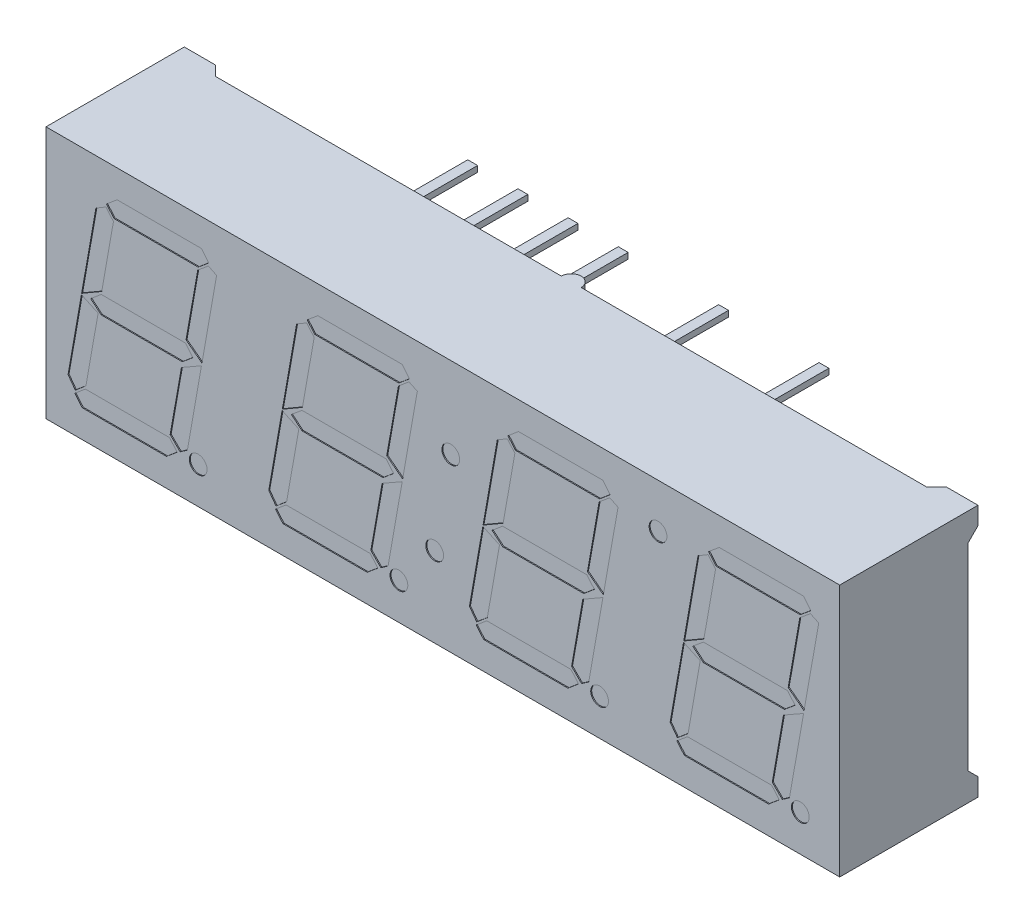
from build123d import *

# Parameters (mm, degrees)
SKETCH1_W           = 40.18
SKETCH1_H           = 12.8
EXTRUDE1_DEPTH      = 7
CUT_EXTRUDE1_DEPTH  = 25.828372883
CUT_EXTRUDE2_DEPTH  = 42.284287568
SKETCH4_R           = 0.5
EXTRUDE3_DEPTH      = 12.8
SKETCH5_R           = 0.45
CUT_EXTRUDE3_DEPTH  = 0.05
LPATTERN1_COUNT     = 4
LPATTERN1_PITCH     = 10.16
SKETCH7_R           = 0.45
L_FEATURES_DEPTH    = 0.05
SKETCH6_W           = 0.5
SKETCH6_H           = 0.3
EXTRUDE4_DEPTH      = 3.9
LPATTERN2_COUNT     = 8
LPATTERN2_PITCH     = 2.54
SKETCH8_W           = 0.5
SKETCH8_H           = 0.3
NC_PIN_REMOVE_DEPTH = 3.9


with BuildPart() as part:
    # Sketch1 → Extrude1 (new body)
    with BuildSketch(Plane.XY):
        Rectangle(SKETCH1_W, SKETCH1_H)
    extrude(amount=EXTRUDE1_DEPTH)

    # Sketch2 → Cut-Extrude1 (cut, through all)
    with BuildSketch(Plane.XZ.offset(6.4)):
        with BuildLine():
            Line((18, 0.5), (19, -0.5))
            Line((19, -0.5), (19, -1.5))
            Line((19, -1.5), (-19, -1.5))
            Line((-19, -1.5), (-19, -0.5))
            Line((-19, -0.5), (-18, 0.5))
            Line((-18, 0.5), (-0.5, 0.5))
            ThreePointArc((-0.5, 0.5), (0, 0), (0.5, 0.5))
            Line((0.5, 0.5), (18, 0.5))
        make_face()
    extrude(amount=-CUT_EXTRUDE1_DEPTH, mode=Mode.SUBTRACT)

    # Sketch3 → Cut-Extrude2 (cut, through all)
    with BuildSketch(Plane(origin=(20.09, 0, 0), x_dir=(0, 0, -1), z_dir=(1, 0, 0))):
        Polygon((-0.5, 5), (-0.5, -5), (0.5, -6), (0.5, 6), align=None)
    extrude(amount=-CUT_EXTRUDE2_DEPTH, mode=Mode.SUBTRACT)

    # Sketch4 → Extrude3 (add)
    with BuildSketch(Plane.XZ.offset(6.4)):
        with Locations((0, 0.5)):
            Circle(SKETCH4_R)
    extrude(amount=-EXTRUDE3_DEPTH)

    # Sketch5 → Cut-Extrude3 (cut)
    with BuildSketch(Plane.XY.offset(7)):
        with Locations((-12.384663494, -4.55)):
            Circle(SKETCH5_R)
        Polygon((-16.490760981, 5), (-12.225969211, 5), (-11.848374377, 4.55), (-12.384663494, 4.1), (-16.649455264, 4.1), (-17.027050098, 4.55), align=None)
        Polygon((-17.293048744, 0.45), (-13.028256974, 0.45), (-12.65066214, 0), (-13.186951256, -0.45), (-17.293048744, -0.45), (-17.82933786, 0), align=None)
        Polygon((-18.095336506, -4.1), (-13.830544736, -4.1), (-13.452949902, -4.55), (-13.989239019, -5), (-18.254030789, -5), (-18.631625623, -4.55), align=None)
        Polygon((-16.675502491, 3.952278837), (-17.053097325, 4.402278837), (-17.563339215, 4.1), (-18.286279836, 0), (-17.268271167, 0.590520617), align=None)
        Polygon((-18.297116707, -0.06145895), (-17.451743026, -0.45), (-18.069289279, -3.952278837), (-18.605578396, -4.402278837), (-18.974356881, -3.902278837), align=None)
        Polygon((-12.409925301, 3.956733175), (-13.001323017, 0.60275006), (-12.195597778, -0.010648477), (-11.452381562, 4.204340135), (-11.873636184, 4.406733175), align=None)
        Polygon((-12.218843124, -0.142479382), (-12.933982668, -4.198237277), (-13.299386951, -4.45409611), (-13.804497509, -3.952278837), (-13.23504098, -0.722730374), align=None)
    cut_extrude3 = extrude(amount=-CUT_EXTRUDE3_DEPTH, mode=Mode.SUBTRACT)

    # LPattern1: Cut-Extrude3 ×4
    with Locations(*[(i * LPATTERN1_PITCH, 0, 0) for i in range(1, LPATTERN1_COUNT)]):
        add(cut_extrude3, mode=Mode.SUBTRACT)

    # Sketch7 → L Features (cut)
    with BuildSketch(Plane.XY.offset(7)):
        with Locations((-0.412165129, -2.337504605)):
            Circle(SKETCH7_R)
        with Locations((0.401979956, 2.279741618)):
            Circle(SKETCH7_R)
        with Locations((10.892139611, 4.152170068)):
            Circle(SKETCH7_R)
    extrude(amount=-L_FEATURES_DEPTH, mode=Mode.SUBTRACT)

    # Sketch6 → Extrude4 (add)
    with BuildSketch(Plane(origin=(0, 0, 0.5), x_dir=(-1, 0, 0), z_dir=(0, 0, -1))):
        with Locations((-8.89, -5.08)):
            Rectangle(SKETCH6_W, SKETCH6_H)
        with Locations((-8.89, 5.08)):
            Rectangle(SKETCH6_W, SKETCH6_H)
    extrude4 = extrude(amount=EXTRUDE4_DEPTH)

    # LPattern2: Extrude4 ×8
    with Locations(*[(-i * LPATTERN2_PITCH, 0, 0) for i in range(1, LPATTERN2_COUNT)]):
        add(extrude4)

    # Sketch8 → NC Pin Remove (cut)
    with BuildSketch(Plane(origin=(0, 0, -3.4), x_dir=(-1, 0, 0), z_dir=(0, 0, -1))):
        with Locations((-6.35, 5.08)):
            Rectangle(SKETCH8_W, SKETCH8_H)
        with Locations((-1.27, 5.08)):
            Rectangle(SKETCH8_W, SKETCH8_H)
    extrude(amount=-NC_PIN_REMOVE_DEPTH, mode=Mode.SUBTRACT)


solid = part.part
